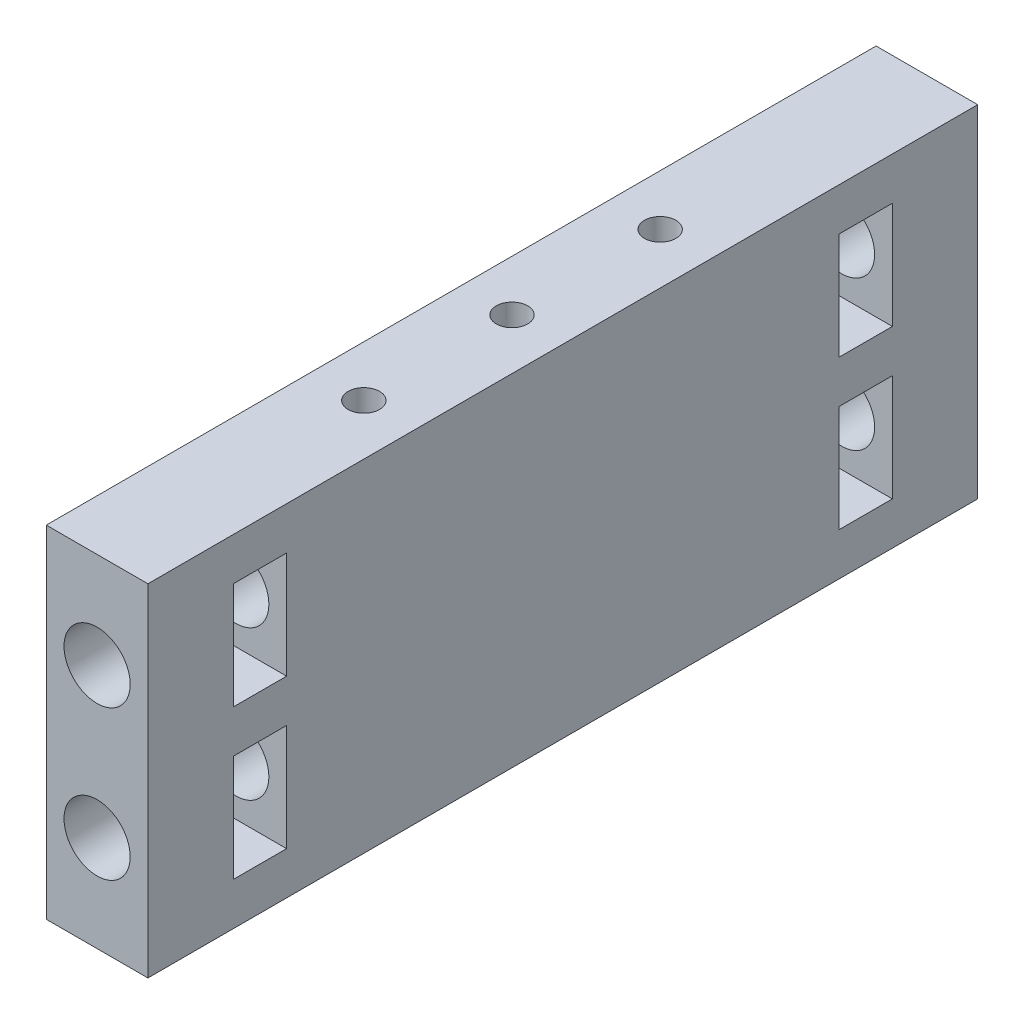
from build123d import *

# Parameters (mm, degrees)
SKETCH1_W               = 9.525
SKETCH1_H               = 32
BOSS_EXTRUDE1_DEPTH     = 77.775
SKETCH2_W               = 5
SKETCH2_H               = 10
NUT_SLOT_DEPTH          = 80.972971997
M6_START                = 9.525
SKETCH3_R               = 3.1
M6_DRILL_DEPTH          = 27
MIRROR2_COPY_1_SKETCH_W = 5
MIRROR2_COPY_1_SKETCH_H = 10
MIRROR2_COPY_1_DEPTH    = 80.972971997
MIRROR2_START           = 9.525
MIRROR2_COPY_2_SKETCH_R = 3.1
MIRROR2_COPY_2_DEPTH    = 27
LPATTERN1_COUNT         = 3
LPATTERN1_PITCH         = 13.8875


with BuildPart() as part:
    # Sketch1 → Boss-Extrude1 (new body)
    with BuildSketch(Plane.XY):
        with Locations((59.5125, 0)):
            Rectangle(SKETCH1_W, SKETCH1_H)
    extrude(amount=BOSS_EXTRUDE1_DEPTH)

    # Sketch2 → Nut Slot (cut, through all)
    with BuildSketch(Plane(origin=(64.275, 0, 0), x_dir=(0, 0, -1), z_dir=(1, 0, 0))):
        with Locations((-67.275, 7)):
            Rectangle(SKETCH2_W, SKETCH2_H)
    nut_slot = extrude(amount=-NUT_SLOT_DEPTH, mode=Mode.SUBTRACT)

    # Sketch3 → M6 Drill (cut)
    with BuildSketch(Plane.XY.offset(77.775).offset(M6_START)):
        with Locations(Location((59.5125, 7, 0), (0, 0, 270))):
            Circle(SKETCH3_R)
    m6_drill = extrude(amount=-M6_DRILL_DEPTH, mode=Mode.SUBTRACT)

    # Mirror1: Nut Slot, M6 Drill across plane
    add(nut_slot.mirror(Plane.ZX), mode=Mode.SUBTRACT)
    add(m6_drill.mirror(Plane.ZX), mode=Mode.SUBTRACT)

    # Mirror2: Nut Slot, M6 Drill across plane
    add(nut_slot.mirror(Plane.XY.offset(38.8875)), mode=Mode.SUBTRACT)
    add(m6_drill.mirror(Plane.XY.offset(38.8875)), mode=Mode.SUBTRACT)

    # Mirror2 copy 1 sketch → Mirror2 copy 1 (cut, through all)
    with BuildSketch(Plane(origin=(64.275, 0, 77.775), x_dir=(0, 0, 1), z_dir=(1, 0, 0))):
        with Locations((-67.275, 7)):
            Rectangle(MIRROR2_COPY_1_SKETCH_W, MIRROR2_COPY_1_SKETCH_H)
    extrude(amount=-MIRROR2_COPY_1_DEPTH, mode=Mode.SUBTRACT)

    # Mirror2 copy 2 sketch → Mirror2 copy 2 (cut)
    with BuildSketch(Plane(origin=(0, 0, 0), x_dir=(1, 0, 0), z_dir=(0, 0, -1)).offset(MIRROR2_START)):
        with Locations(Location((59.5125, 7, 0), (0, 0, 270))):
            Circle(MIRROR2_COPY_2_SKETCH_R)
    extrude(amount=-MIRROR2_COPY_2_DEPTH, mode=Mode.SUBTRACT)

    # Sketch7 → #32 (0.116) Diameter Hole1 (revolve, cut)
    with BuildSketch(Plane(origin=(59.5125, -16, 52.775), x_dir=(0, 0, -1), z_dir=(1, 0, 0))):
        Polygon((0, 0), (0, 10.410187864), (1.4732, 9.525), (1.4732, 0), align=None)
    f_32_0_116_diameter_hole1 = revolve(axis=Axis((59.5125, -22.35, 52.775), (0, 1, 0)), mode=Mode.SUBTRACT)

    # LPattern1: #32 (0.116) Diameter Hole1 ×3
    with Locations(*[(0, 0, -i * LPATTERN1_PITCH) for i in range(1, LPATTERN1_COUNT)]):
        add(f_32_0_116_diameter_hole1, mode=Mode.SUBTRACT)

    # Mirror3: #32 (0.116) Diameter Hole1 across plane
    add(f_32_0_116_diameter_hole1.mirror(Plane.ZX), mode=Mode.SUBTRACT)

    # Mirror3 copy 1 sketch → Mirror3 copy 1 (revolve, cut)
    with BuildSketch(Plane(origin=(59.5125, 16, 38.8875), x_dir=(0, 0, -1), z_dir=(1, 0, 0))):
        Polygon((0, 0), (0, -10.410187864), (1.4732, -9.525), (1.4732, 0), align=None)
    revolve(axis=Axis((59.5125, 22.35, 38.8875), (0, 1, 0)), mode=Mode.SUBTRACT)

    # Mirror3 copy 2 sketch → Mirror3 copy 2 (revolve, cut)
    with BuildSketch(Plane(origin=(59.5125, 16, 25), x_dir=(0, 0, -1), z_dir=(1, 0, 0))):
        Polygon((0, 0), (0, -10.410187864), (1.4732, -9.525), (1.4732, 0), align=None)
    revolve(axis=Axis((59.5125, 22.35, 25), (0, 1, 0)), mode=Mode.SUBTRACT)


solid = part.part
